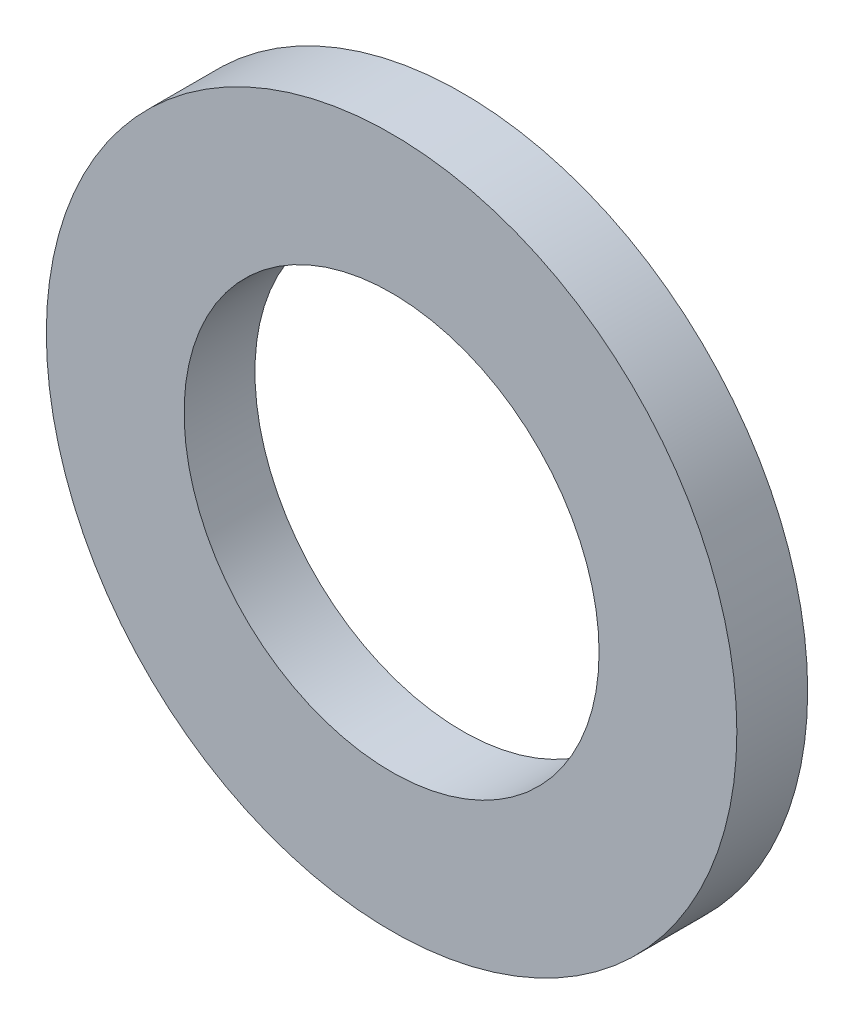
from build123d import *

# Parameters (mm, degrees)
SKETCH1_R           = 3.9624
SKETCH1_R_2         = 2.38125
BOSS_EXTRUDE1_DEPTH = 0.8128


with BuildPart() as part:
    # Sketch1 → Boss-Extrude1 (new body)
    with BuildSketch(Plane.XY):
        Circle(SKETCH1_R)
        Circle(SKETCH1_R_2, mode=Mode.SUBTRACT)
    extrude(amount=BOSS_EXTRUDE1_DEPTH)


solid = part.part
